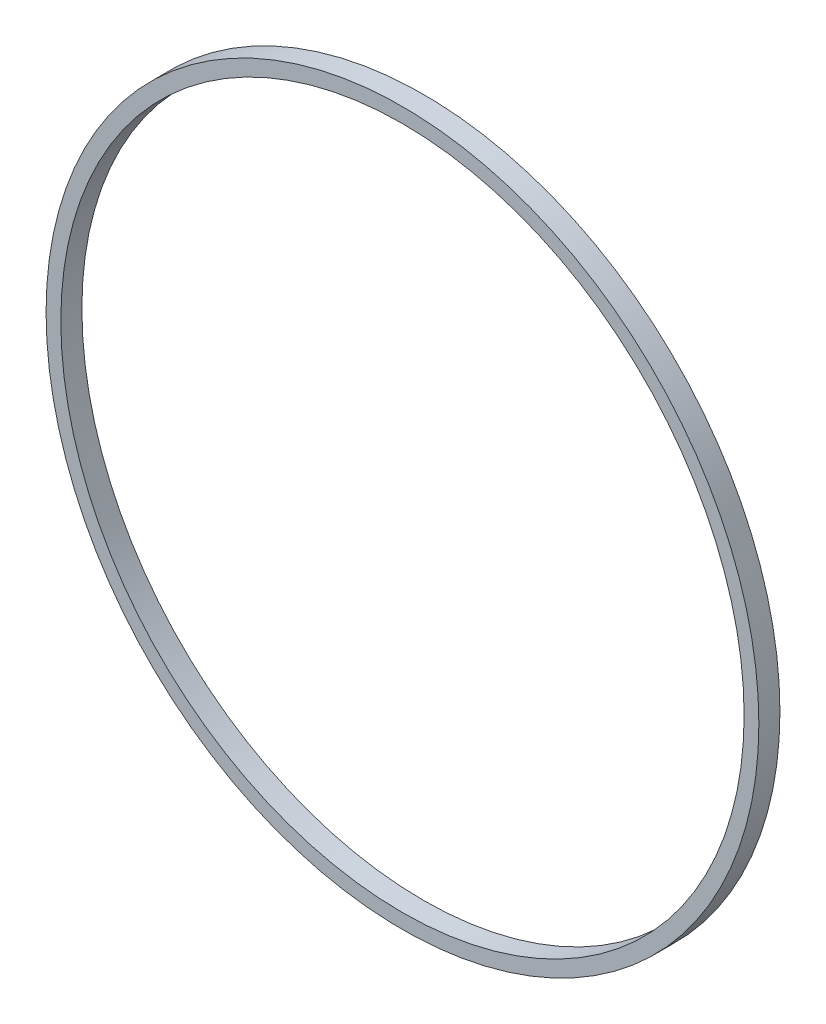
from build123d import *

# Parameters (mm, degrees)
SKETCH_1_R      = 84.6
SKETCH_1_R_2    = 81.1
EXTRUDE_1_DEPTH = 5


with BuildPart() as part:
    # 스케치1 → 보스-돌출1 (new body)
    with BuildSketch(Plane.XY):
        Circle(SKETCH_1_R)
        Circle(SKETCH_1_R_2, mode=Mode.SUBTRACT)
    extrude(amount=EXTRUDE_1_DEPTH)


solid = part.part
